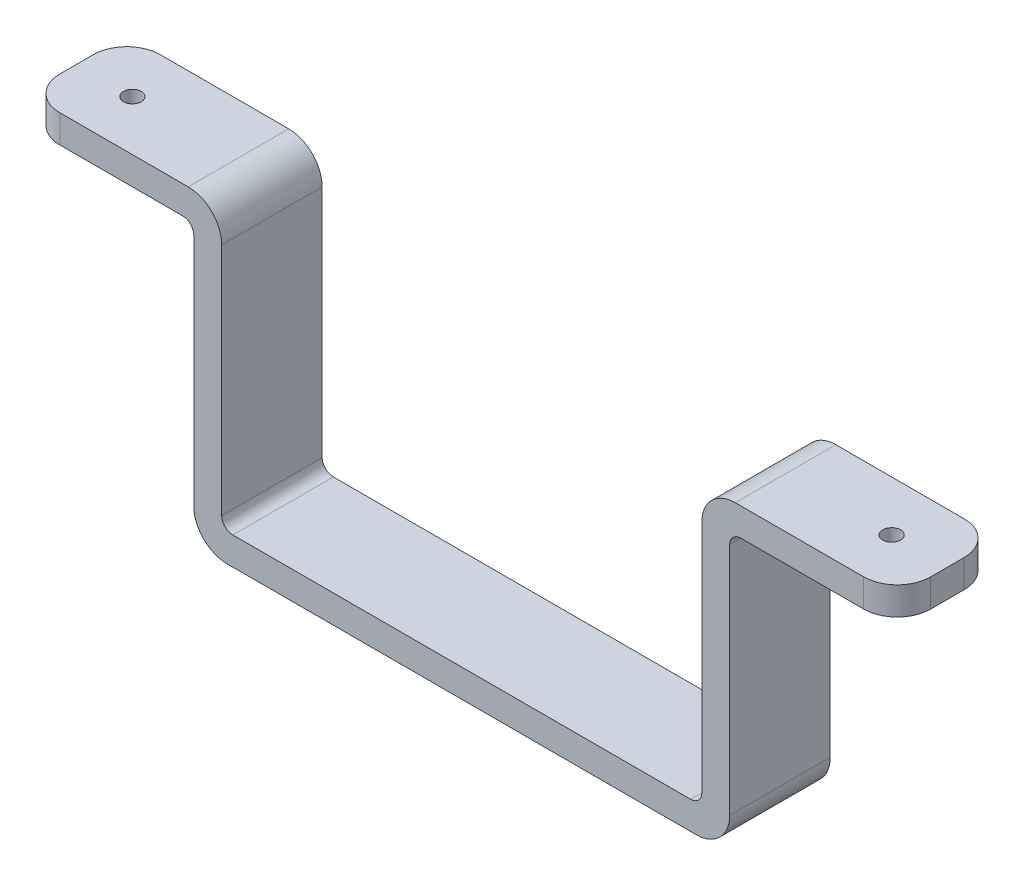
from build123d import *

# Parameters (mm, degrees)
BOSS_EXTRUDE1_DEPTH = 9
SKETCH2_R           = 0.8
CUT_EXTRUDE1_DEPTH  = 9
FILLET1_R           = 1
FILLET2_R           = 3
FILLET3_R           = 3


with BuildPart() as part:
    # Sketch1 → Boss-Extrude1 (new body)
    with BuildSketch(Plane.XY):
        Polygon((-45.480536292, -17.354415164), (-45.480536292, 7.645584836), (-60.480536292, 7.645584836), (-60.480536292, 10.145584836), (-42.980536292, 10.145584836), (-42.980536292, -14.854415164), (0.019463708, -14.854415164), (0.019463708, 10.145584836), (17.519463708, 10.145584836), (17.519463708, 7.645584836), (2.519463708, 7.645584836), (2.519463708, -17.354415164), align=None)
    extrude(amount=BOSS_EXTRUDE1_DEPTH)

    # Sketch2 → Cut-Extrude1 (cut)
    with BuildSketch(Plane(origin=(0, 10.145584836, 0), x_dir=(1, 0, 0), z_dir=(0, 1, 0))):
        with Locations(Location((-55.480536292, -4.5, 0), (0, 0, 270))):
            Circle(SKETCH2_R)
        with Locations(Location((12.519463708, -4.5, 0), (0, 0, 270))):
            Circle(SKETCH2_R)
    extrude(amount=-CUT_EXTRUDE1_DEPTH, mode=Mode.SUBTRACT)

    # Fillet1
    fillet1_edges = [part.edges().sort_by_distance(p)[0] for p in [
        (-45.480536292, 7.645584836, 4.5),
        (-42.980536292, -14.854415164, 4.5),
        (0.019463708, -14.854415164, 4.5),
        (2.519463708, 7.645584836, 4.5),
    ]]
    fillet(fillet1_edges, radius=FILLET1_R)

    # Fillet2
    fillet2_edges = [part.edges().sort_by_distance(p)[0] for p in [
        (-45.480536292, -17.354415164, 4.5),
        (-42.980536292, 10.145584836, 4.5),
        (0.019463708, 10.145584836, 4.5),
        (2.519463708, -17.354415164, 4.5),
    ]]
    fillet(fillet2_edges, radius=FILLET2_R)

    # Fillet3
    fillet3_edges = [part.edges().sort_by_distance(p)[0] for p in [
        (-60.480536292, 8.895584836, 0),
        (17.519463708, 8.895584836, 0),
        (17.519463708, 8.895584836, 9),
        (-60.480536292, 8.895584836, 9),
    ]]
    fillet(fillet3_edges, radius=FILLET3_R)


solid = part.part
